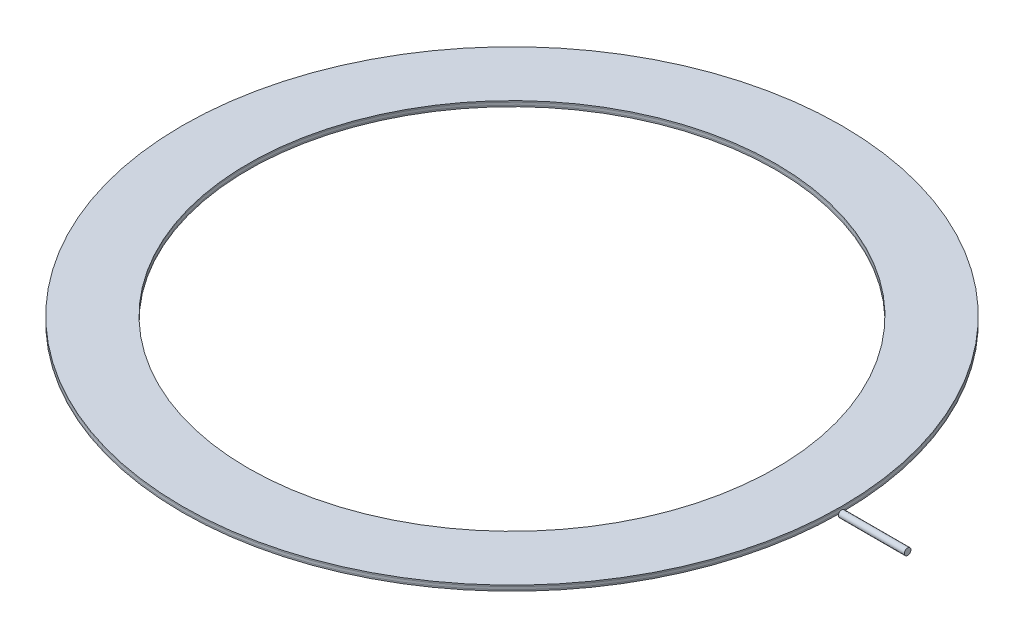
from build123d import *

# Parameters (mm, degrees)
SKETCH1_R           = 25
SKETCH1_R_2         = 20
BOSS_EXTRUDE1_DEPTH = 0.1
SWEEP1_PROFILE_R    = 0.08
SWEEP2_PROFILE_R    = 0.25
SKETCH18_R          = 25
SKETCH18_R_2        = 20
BOSS_EXTRUDE2_DEPTH = 0.2
SKETCH19_R          = 25
SKETCH19_R_2        = 20
BOSS_EXTRUDE3_DEPTH = 0.1


with BuildPart() as part:
    # Sketch1 → Boss-Extrude1 (new body)
    with BuildSketch(Plane(origin=(0, 0, 0), x_dir=(1, 0, 0), z_dir=(0, 1, 0))):
        with Locations(Location((0, 0, 0), (0, 0, 270))):
            Circle(SKETCH1_R)
        with Locations(Location((0, 0, 0), (0, 0, 270))):
            Circle(SKETCH1_R_2, mode=Mode.SUBTRACT)
    extrude(amount=BOSS_EXTRUDE1_DEPTH)


with BuildPart() as body_2:
    # Sweep1: sweep along a path in Sketch2
    with BuildLine(Plane.XY) as sweep1_path:
        Line((22.5, -0.08), (25, -0.08))
    # Sweep1 profile (on start of the path) → Sweep1 (sweep)
    with BuildSketch(Plane(origin=(22.5, -0.08, 0), x_dir=(0, 1, 0), z_dir=(1, 0, 0))):
        Circle(SWEEP1_PROFILE_R)
    sweep(path=sweep1_path.line)

    # Sweep2: sweep along a path in Sketch11
    with BuildLine(Plane.XY) as sweep2_path:
        Line((25, -0.08), (30, -0.08))
    # Sweep2 profile (on start of the path) → Sweep2 (sweep)
    with BuildSketch(Plane(origin=(25, -0.08, 0), x_dir=(0, 0, 1), z_dir=(1, 0, 0))):
        Circle(SWEEP2_PROFILE_R)
    sweep(path=sweep2_path.line)


with BuildPart() as body_3:
    # Sketch18 → Boss-Extrude2 (new body)
    with BuildSketch(Plane(origin=(0, 0.1, 0), x_dir=(1, 0, 0), z_dir=(0, 1, 0))):
        with Locations(Location((0, 0, 0), (0, 0, 270))):
            Circle(SKETCH18_R)
        with Locations(Location((0, 0, 0), (0, 0, 270))):
            Circle(SKETCH18_R_2, mode=Mode.SUBTRACT)
    extrude(amount=BOSS_EXTRUDE2_DEPTH)


with BuildPart() as body_4:
    # Sketch19 → Boss-Extrude3 (new body)
    with BuildSketch(Plane(origin=(0, 0.3, 0), x_dir=(1, 0, 0), z_dir=(0, 1, 0))):
        with Locations(Location((0, 0, 0), (0, 0, 270))):
            Circle(SKETCH19_R)
        with Locations(Location((0, 0, 0), (0, 0, 270))):
            Circle(SKETCH19_R_2, mode=Mode.SUBTRACT)
    extrude(amount=BOSS_EXTRUDE3_DEPTH)


solid = Compound([part.part, body_2.part, body_3.part, body_4.part])
